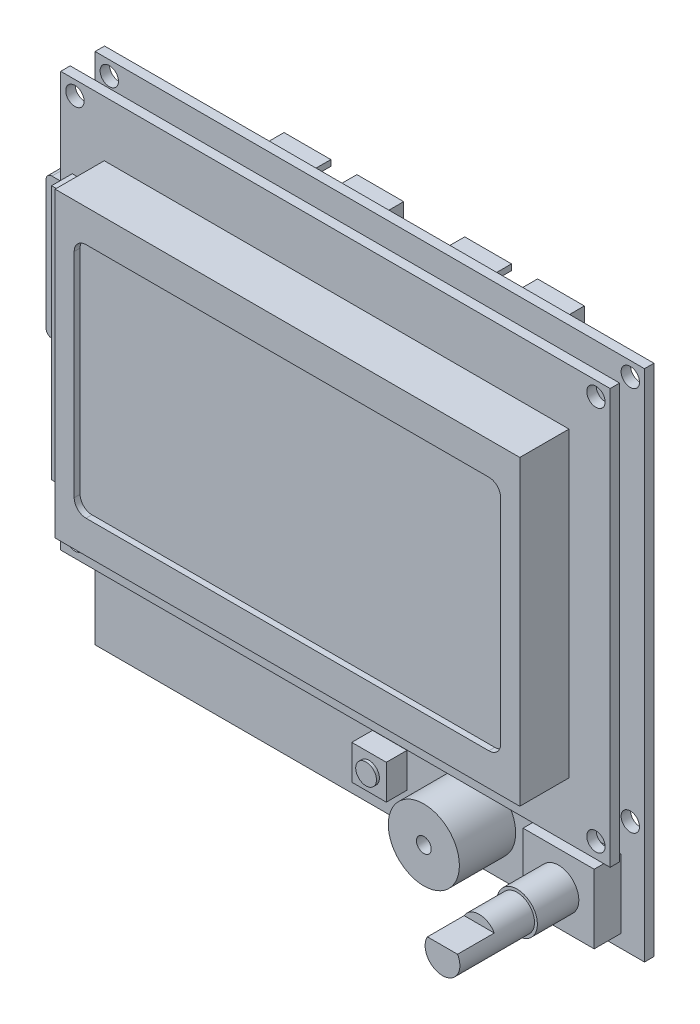
from build123d import *

# Parameters (mm, degrees)
SKETCH1_W                             = 92.75
SKETCH1_H                             = 86.75
SKETCH1_R                             = 1.55
BOSS_EXTRUDE1_FIRST_PCB_DEPTH         = 1.6
SKETCH2_R                             = 6
BOSS_EXTRUDE2_SPEAKER_DEPTH           = 9.5
SKETCH15_R                            = 1.25
CUT_EXTRUDE1_SPEAKER_HOLE_DEPTH       = 5
SKETCH3_W                             = 12
SKETCH3_H                             = 11.65
BOSS_EXTRUDE3_ROTARY_SWITCH_DEPTH     = 4.5
SKETCH4_W                             = 5.83
SKETCH4_H                             = 5.83
BOSS_EXTRUDE4_RESET_SWITCH_DEPTH      = 3.5
SKETCH5_R                             = 1.75
BOSS_EXTRUDE5_RESET_BUTTON_DEPTH      = 0.5
SKETCH16_R                            = 3.415
BOSS_EXTRUDE6_ROTARY_SWITCH_DEPTH     = 7
SKETCH17_R                            = 2.935
BOSS_EXTRUDE7_ROTARY_SWITCH_DEPTH     = 6.4
BOSS_EXTRUDE8_ROTARY_SWITCH_DEPTH     = 6.2
BOSS_EXTRUDE9_SD_CARD_SLOT_DEPTH      = 3
SKETCH19_W                            = 50
SKETCH19_H                            = 2.5
BOSS_EXTRUDE10_CONNECTOR_DEPTH        = 4.2
SKETCH11_W                            = 92.75
SKETCH11_H                            = 70
SKETCH11_R                            = 1.55
BOSS_EXTRUDE11_UPPER_PCB_DEPTH        = 1.6
SKETCH12_W                            = 78.45
SKETCH12_H                            = 51
BOSS_EXTRUDE12_LCD_DEPTH              = 8.3
SKETCH24_W                            = 5.4
SKETCH24_H                            = 43
BOSS_EXTRUDE13_LCD_BUMPOUT_DEPTH      = 3.5
CUT_EXTRUDE2_SCREEN_RECESS_DEPTH      = 1
SKETCH21_W                            = 20.2
SKETCH21_H                            = 8.85
SKETCH21_W_2                          = 18.2
SKETCH21_H_2                          = 6.85
BOSS_EXTRUDE14_CONNECTORS_DEPTH       = 9
SKETCH22_W                            = 18.2
SKETCH22_H                            = 6.85
BOSS_EXTRUDE15_CONNECTOR_RECESS_DEPTH = 2.55
SKETCH23_W                            = 4.4
SKETCH23_H                            = 1
CUT_EXTRUDE3_CONNECTOR_NOTCH_DEPTH    = 6.45
SKETCH20_W                            = 2.153
SKETCH20_H                            = 23.75
BOSS_EXTRUDE16_SD_CARD_DEPTH          = 10.4
FILLET1_SD_CARD_R                     = 1


with BuildPart() as part:
    # Sketch1 → Boss-Extrude1 - First PCB (new body)
    with BuildSketch(Plane.XY):
        Rectangle(SKETCH1_W, SKETCH1_H)
        with Locations((-43.975, 40.975)):
            Circle(SKETCH1_R, mode=Mode.SUBTRACT)
        with Locations(Location((43.975, 40.975, 0), (0, 0, 180))):
            Circle(SKETCH1_R, mode=Mode.SUBTRACT)
        with Locations((43.975, -24.025)):
            Circle(SKETCH1_R, mode=Mode.SUBTRACT)
        with Locations(Location((-43.975, -24.025, 0), (0, 0, 180))):
            Circle(SKETCH1_R, mode=Mode.SUBTRACT)
    extrude(amount=BOSS_EXTRUDE1_FIRST_PCB_DEPTH)

    # Sketch2 → Boss-Extrude2 - Speaker (add)
    with BuildSketch(Plane.XY.offset(1.6)):
        with Locations(Location((18.625, -35.375, 0), (0, 0, 180))):
            Circle(SKETCH2_R)
    extrude(amount=BOSS_EXTRUDE2_SPEAKER_DEPTH)

    # Sketch15 → Cut-Extrude1 - Speaker Hole (cut)
    with BuildSketch(Plane.XY.offset(11.1)):
        with Locations((18.625, -35.375)):
            Circle(SKETCH15_R)
    extrude(amount=-CUT_EXTRUDE1_SPEAKER_HOLE_DEPTH, mode=Mode.SUBTRACT)

    # Sketch3 → Boss-Extrude3 - Rotary Switch (add)
    with BuildSketch(Plane(origin=(0, 0, 1.6), x_dir=(-1, 0, 0), z_dir=(0, 0, 1))):
        with Locations((-36.375, 35.375)):
            Rectangle(SKETCH3_W, SKETCH3_H)
    extrude(amount=BOSS_EXTRUDE3_ROTARY_SWITCH_DEPTH)

    # Sketch4 → Boss-Extrude4 - Reset Switch (add)
    with BuildSketch(Plane(origin=(0, 0, 1.6), x_dir=(-1, 0, 0), z_dir=(0, 0, 1))):
        with Locations((-3.375, 35.375)):
            Rectangle(SKETCH4_W, SKETCH4_H)
    extrude(amount=BOSS_EXTRUDE4_RESET_SWITCH_DEPTH)

    # Sketch5 → Boss-Extrude5 - Reset Button (add)
    with BuildSketch(Plane(origin=(0, 0, 5.1), x_dir=(-1, 0, 0), z_dir=(0, 0, 1))):
        with Locations(Location((-3.375, 35.375, 0), (0, 0, 180))):
            Circle(SKETCH5_R)
    extrude(amount=BOSS_EXTRUDE5_RESET_BUTTON_DEPTH)

    # Sketch16 → Boss-Extrude6 - Rotary Switch (add)
    with BuildSketch(Plane.XY.offset(6.1)):
        with Locations((36.375, -35.375)):
            Circle(SKETCH16_R)
    extrude(amount=BOSS_EXTRUDE6_ROTARY_SWITCH_DEPTH)

    # Sketch17 → Boss-Extrude7 - Rotary Switch (add)
    with BuildSketch(Plane.XY.offset(13.1)):
        with Locations((36.375, -35.375)):
            Circle(SKETCH17_R)
    extrude(amount=BOSS_EXTRUDE7_ROTARY_SWITCH_DEPTH)

    # Sketch18 → Boss-Extrude8 - Rotary Switch (add)
    with BuildSketch(Plane.XY.offset(19.5)):
        with BuildLine():
            Line((33.831773703, -33.91), (38.918226297, -33.91))
            ThreePointArc((38.918226297, -33.91), (36.375, -38.31), (33.831773703, -33.91))
        make_face()
    extrude(amount=BOSS_EXTRUDE8_ROTARY_SWITCH_DEPTH)

    # Sketch9 → Boss-Extrude9 - SD Card Slot (add)
    with BuildSketch(Plane(origin=(0, 0, 0), x_dir=(1, 0, 0), z_dir=(0, 0, -1))):
        Polygon((-46.125, 5.425), (-27.875, 5.425), (-25.875, 3.425), (-20.375, 3.425), (-20.375, -20.975), (-46.125, -20.975), align=None)
    extrude(amount=BOSS_EXTRUDE9_SD_CARD_SLOT_DEPTH)

    # Sketch19 → Boss-Extrude10 - Connector (add)
    with BuildSketch(Plane.XY.offset(1.6)):
        with Locations((-8.375, -24.125)):
            Rectangle(SKETCH19_W, SKETCH19_H)
    extrude(amount=BOSS_EXTRUDE10_CONNECTOR_DEPTH)

    # Sketch11 → Boss-Extrude11 - Upper PCB (add)
    with BuildSketch(Plane(origin=(0, -2, 5.8), x_dir=(1, 0, 0), z_dir=(0, 0, -1))):
        with Locations((0, -10.375)):
            Rectangle(SKETCH11_W, SKETCH11_H)
        with Locations((-43.975, -42.975)):
            Circle(SKETCH11_R, mode=Mode.SUBTRACT)
        with Locations(Location((-43.975, 22.025, 0), (0, 0, 180))):
            Circle(SKETCH11_R, mode=Mode.SUBTRACT)
        with Locations(Location((43.975, -42.975, 0), (0, 0, 180))):
            Circle(SKETCH11_R, mode=Mode.SUBTRACT)
        with Locations((43.975, 22.025)):
            Circle(SKETCH11_R, mode=Mode.SUBTRACT)
    extrude(amount=-BOSS_EXTRUDE11_UPPER_PCB_DEPTH)

    # Sketch12 → Boss-Extrude12 - LCD (add)
    with BuildSketch(Plane(origin=(0, 0, 7.4), x_dir=(-1, 0, 0), z_dir=(0, 0, 1))):
        with Locations((-0.2, -8.475)):
            Rectangle(SKETCH12_W, SKETCH12_H)
    extrude(amount=BOSS_EXTRUDE12_LCD_DEPTH)

    # Sketch24 → Boss-Extrude13 - LCD Bumpout (add)
    with BuildSketch(Plane.XY.offset(7.4)):
        with Locations((-41.725, 7.875)):
            Rectangle(SKETCH24_W, SKETCH24_H)
    extrude(amount=BOSS_EXTRUDE13_LCD_BUMPOUT_DEPTH)

    # Sketch13 → Cut-Extrude2 - Screen Recess (cut)
    with BuildSketch(Plane(origin=(0, 0, 15.7), x_dir=(-1, 0, 0), z_dir=(0, 0, 1))):
        with BuildLine():
            Line((-34.2, 11.525), (33.8, 11.525))
            ThreePointArc((33.8, 11.525), (35.214213562, 10.939213562), (35.8, 9.525))
            Line((35.8, 9.525), (35.8, -26.475))
            ThreePointArc((35.8, -26.475), (35.214213562, -27.889213562), (33.8, -28.475))
            Line((33.8, -28.475), (-34.2, -28.475))
            ThreePointArc((-34.2, -28.475), (-35.614213562, -27.889213562), (-36.2, -26.475))
            Line((-36.2, -26.475), (-36.2, 9.525))
            ThreePointArc((-36.2, 9.525), (-35.614213562, 10.939213562), (-34.2, 11.525))
        make_face()
    extrude(amount=-CUT_EXTRUDE2_SCREEN_RECESS_DEPTH, mode=Mode.SUBTRACT)

    # Sketch21 → Boss-Extrude14 - Connectors (add)
    # profile 1 of 2: a face of its own
    with BuildSketch(Plane(origin=(0, 0, 0), x_dir=(-1, 0, 0), z_dir=(0, 0, -1))):
        with Locations((-15.525, 32.45)):
            Rectangle(SKETCH21_W, SKETCH21_H)
        with Locations((-15.525, 32.45)):
            Rectangle(SKETCH21_W_2, SKETCH21_H_2, mode=Mode.SUBTRACT)
    # profile 2 of 2: a face of its own
    with BuildSketch(Plane(origin=(0, 0, 0), x_dir=(-1, 0, 0), z_dir=(0, 0, -1))):
        with Locations((14.975, 32.45)):
            Rectangle(SKETCH21_W, SKETCH21_H)
        with Locations((14.975, 32.45)):
            Rectangle(SKETCH21_W_2, SKETCH21_H_2, mode=Mode.SUBTRACT)
    extrude(amount=BOSS_EXTRUDE14_CONNECTORS_DEPTH)

    # Sketch22 → Boss-Extrude15 - Connector Recess (add)
    with BuildSketch(Plane(origin=(0, 0, 0), x_dir=(-1, 0, 0), z_dir=(0, 0, -1))):
        with Locations((-15.525, 32.45)):
            Rectangle(SKETCH22_W, SKETCH22_H)
        with Locations((14.975, 32.45)):
            Rectangle(SKETCH22_W, SKETCH22_H)
    extrude(amount=BOSS_EXTRUDE15_CONNECTOR_RECESS_DEPTH)

    # Sketch23 → Cut-Extrude3 - Connector Notch (cut)
    with BuildSketch(Plane(origin=(0, 0, -9), x_dir=(-1, 0, 0), z_dir=(0, 0, -1))):
        with Locations((-15.525, 36.375)):
            Rectangle(SKETCH23_W, SKETCH23_H)
        with Locations((14.975, 36.375)):
            Rectangle(SKETCH23_W, SKETCH23_H)
    extrude(amount=-CUT_EXTRUDE3_CONNECTOR_NOTCH_DEPTH, mode=Mode.SUBTRACT)

    # Sketch20 → Boss-Extrude16 - SD Card (add)
    with BuildSketch(Plane.ZY.offset(46.125)):
        with Locations((-1.3465, 7.775)):
            Rectangle(SKETCH20_W, SKETCH20_H)
    extrude(amount=BOSS_EXTRUDE16_SD_CARD_DEPTH)

    # Fillet1 - SD Card
    fillet1_sd_card_edges = [part.edges().sort_by_distance(p)[0] for p in [
        (-56.525, -4.1, -1.3465),
        (-56.525, 19.65, -1.3465),
    ]]
    fillet(fillet1_sd_card_edges, radius=FILLET1_SD_CARD_R)


solid = part.part
